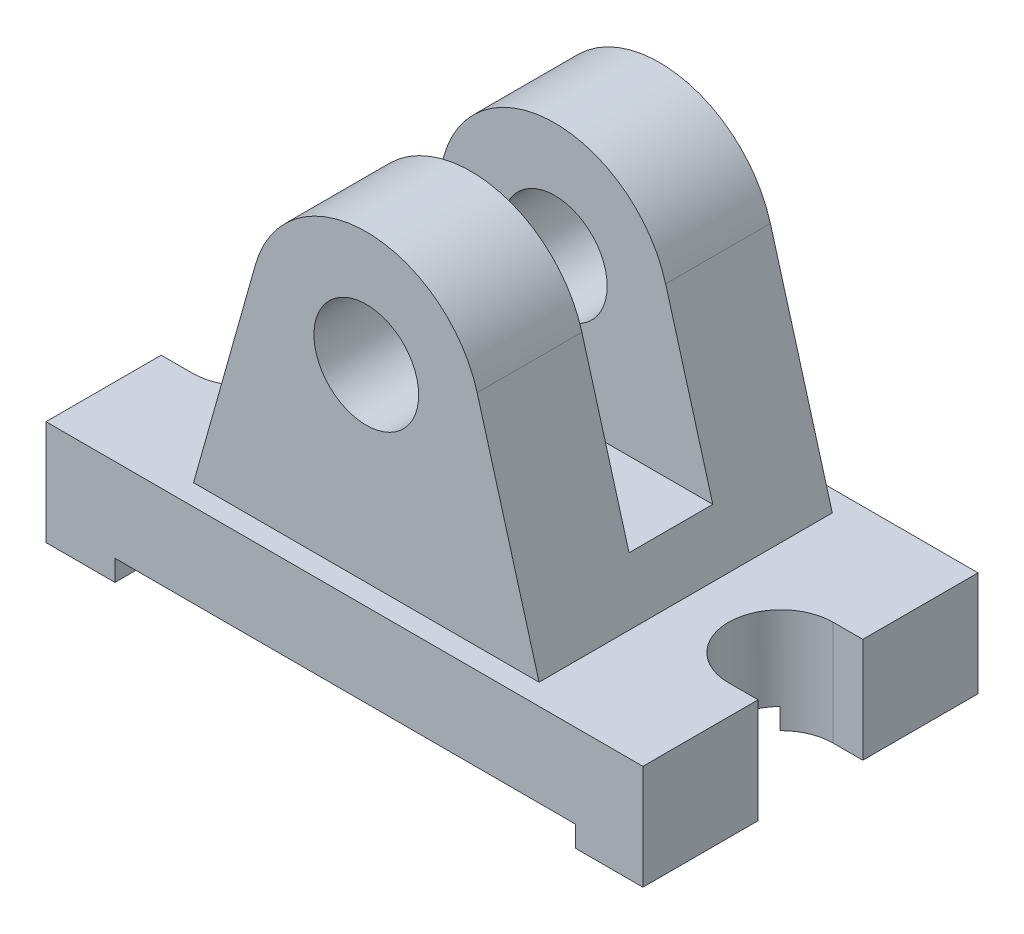
from build123d import *

# Parameters (mm, degrees)
SKETCH_1_W          = 57
SKETCH_1_H          = 10
EXTRUDE_1_DEPTH     = 32
SKETCH_2_R          = 5
SKETCH_2_W          = 57
SKETCH_2_H          = 10
EXTRUDE_4_DEPTH     = 28
SKETCH_2_8_R        = 5
SKETCH_2_8_W        = 57
SKETCH_2_8_H        = 10
EXTRUDE_5_DEPTH     = 28
SKETCH_7_W          = 44
SKETCH_7_H          = 2
CUT_EXTRUDE_1_DEPTH = 58.983945463
CUT_EXTRUDE_3_DEPTH = 51.932680387
SKETCH_9_W          = 8
SKETCH_9_H          = 24
CUT_EXTRUDE_4_DEPTH = 20


with BuildPart() as part:
    # 草图1 → 凸台-拉伸1 (new body)
    with BuildSketch(Plane.XY.offset(16)):
        with Locations((-0.085624559, 5)):
            Rectangle(SKETCH_1_W, SKETCH_1_H)
    extrude(amount=-EXTRUDE_1_DEPTH)

    # 草图2 → 凸台-拉伸4 (add)
    # profile 1 of 2: a face of its own
    with BuildSketch(Plane.XY.offset(14)):
        with BuildLine():
            Line((-16.5, 10), (16.5, 10))
            Line((16.5, 10), (10.58774912, 30.983214471))
            ThreePointArc((10.58774912, 30.983214471), (0, 39), (-10.58774912, 30.983214471))
            Line((-10.58774912, 30.983214471), (-16.5, 10))
        make_face()
        with Locations((0, 28)):
            Circle(SKETCH_2_R, mode=Mode.SUBTRACT)
    # profile 2 of 2: a face of its own
    with BuildSketch(Plane.XY.offset(14)):
        with Locations((-0.085624559, 5)):
            Rectangle(SKETCH_2_W, SKETCH_2_H)
    extrude(amount=-EXTRUDE_4_DEPTH)

    # 草图2<8> → 凸台-拉伸5 (add)
    # profile 1 of 2: a face of its own
    with BuildSketch(Plane.XY.offset(14)):
        with BuildLine():
            Line((-16.5, 10), (16.5, 10))
            Line((16.5, 10), (10.58774912, 30.983214471))
            ThreePointArc((10.58774912, 30.983214471), (0, 39), (-10.58774912, 30.983214471))
            Line((-10.58774912, 30.983214471), (-16.5, 10))
        make_face()
        with Locations((0, 28)):
            Circle(SKETCH_2_8_R, mode=Mode.SUBTRACT)
    # profile 2 of 2: a face of its own
    with BuildSketch(Plane.XY.offset(14)):
        with Locations((-0.085624559, 5)):
            Rectangle(SKETCH_2_8_W, SKETCH_2_8_H)
    extrude(amount=-EXTRUDE_5_DEPTH)

    # 草图7 → 切除-拉伸1 (cut, through all)
    with BuildSketch(Plane.XY.offset(16)):
        with Locations((0, 1)):
            Rectangle(SKETCH_7_W, SKETCH_7_H)
    extrude(amount=-CUT_EXTRUDE_1_DEPTH, mode=Mode.SUBTRACT)

    # 草图8 → 切除-拉伸3 (cut, symmetric)
    with BuildSketch(Plane(origin=(0, 0, 0), x_dir=(1, 0, 0), z_dir=(0, 1, 0))):
        with BuildLine():
            Line((-160.076364947, -5), (-28.585624559, -5))
            Line((-28.585624559, -5), (-25.585624559, -5))
            ThreePointArc((-25.585624559, -5), (-20.585624559, 0), (-25.585624559, 5))
            Line((-25.585624559, 5), (-28.585624559, 5))
            Line((-28.585624559, 5), (-160.076364947, 5))
            Line((-160.076364947, 5), (-423.057845722, 5))
            Line((-423.057845722, 5), (-423.057845722, -5))
            Line((-423.057845722, -5), (-160.076364947, -5))
        make_face()
    cut_extrude_3 = extrude(amount=CUT_EXTRUDE_3_DEPTH, both=True, mode=Mode.SUBTRACT)

    # 镜向1: 切除-拉伸3 across plane
    add(cut_extrude_3.mirror(Plane(origin=(0, 0, 0), x_dir=(0, 0, 1), z_dir=(1, 0, 0))), mode=Mode.SUBTRACT)

    # 草图9 → 切除-拉伸4 (cut, symmetric)
    with BuildSketch(Plane(origin=(0, 0, 0), x_dir=(0, 0, -1), z_dir=(1, 0, 0))):
        with Locations((0, 27)):
            Rectangle(SKETCH_9_W, SKETCH_9_H)
    extrude(amount=CUT_EXTRUDE_4_DEPTH, both=True, mode=Mode.SUBTRACT)


solid = part.part
